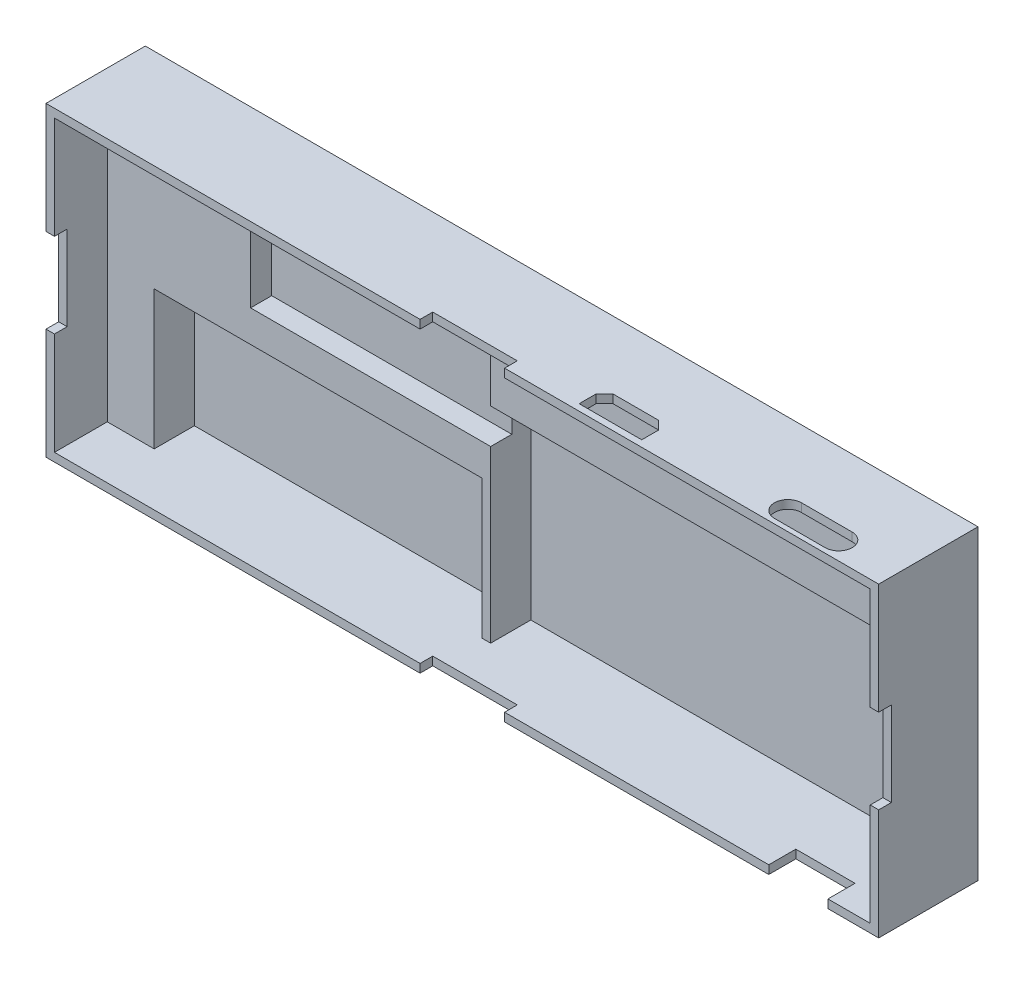
from build123d import *

# Parameters (mm, degrees)
CROQUIS1_W              = 96.5
CROQUIS1_H              = 34.25
SALIENTE_EXTRUIR1_DEPTH = 0.75
CROQUIS3_W              = 98.5
CROQUIS3_H              = 36.25
CROQUIS3_W_2            = 96.5
CROQUIS3_H_2            = 34.25
SALIENTE_EXTRUIR2_DEPTH = 11.75
SALIENTE_EXTRUIR3_DEPTH = 4.75
SALIENTE_EXTRUIR4_DEPTH = 3
SALIENTE_EXTRUIR5_DEPTH = 2.5
CROQUIS8_W              = 1
CROQUIS8_H              = 14.1
CORTAR_EXTRUIR1_DEPTH   = 2.5
CORTAR_EXTRUIR2_DEPTH   = 2.5
CORTAR_EXTRUIR3_DEPTH   = 1.5
CROQUIS11_W             = 7
CROQUIS11_H             = 3.2
CORTAR_EXTRUIR4_DEPTH   = 10


with BuildPart() as part:
    # Croquis1 → Saliente-Extruir1 (new body)
    with BuildSketch(Plane.XY):
        with Locations((-2.825600583, 9.945957096)):
            Rectangle(CROQUIS1_W, CROQUIS1_H)
    extrude(amount=SALIENTE_EXTRUIR1_DEPTH)

    # Croquis3 → Saliente-Extruir2 (add)
    with BuildSketch(Plane(origin=(0, 0, 0), x_dir=(-1, 0, 0), z_dir=(0, 0, -1))):
        with Locations((2.825600583, 9.945957096)):
            Rectangle(CROQUIS3_W, CROQUIS3_H)
        with Locations((2.825600583, 9.945957096)):
            Rectangle(CROQUIS3_W_2, CROQUIS3_H_2, mode=Mode.SUBTRACT)
    extrude(amount=-SALIENTE_EXTRUIR2_DEPTH)

    # Croquis5 → Saliente-Extruir3 (add)
    with BuildSketch(Plane.XY.offset(0.75)):
        Polygon((-5.725600583, -7.179042904), (-5.725600583, 17.120957096), (45.424399417, 17.120957096), (45.424399417, 27.070957096), (-6.725600583, 27.070957096), (-6.725600583, -7.179042904), align=None)
    extrude(amount=SALIENTE_EXTRUIR3_DEPTH)

    # Croquis6 → Saliente-Extruir4 (add)
    with BuildSketch(Plane.XY):
        Polygon((-6.725600583, 9.220957096), (-6.725600583, 27.070957096), (-51.075600583, 27.070957096), (-51.075600583, -7.179042904), (-45.525600583, -7.179042904), (-45.525600583, 9.220957096), align=None)
    extrude(amount=SALIENTE_EXTRUIR4_DEPTH)

    # Croquis7 → Saliente-Extruir5 (add)
    with BuildSketch(Plane.XY.offset(3)):
        Polygon((-34.125600583, 27.070957096), (-51.075600583, 27.070957096), (-51.075600583, -7.179042904), (-45.525600583, -7.179042904), (-45.525600583, 9.220957096), (-6.725600583, 9.220957096), (-6.725600583, 12.970957096), (-34.125600583, 12.970957096), align=None)
    extrude(amount=SALIENTE_EXTRUIR5_DEPTH)

    # Croquis8 → Cortar-Extruir1 (cut)
    with BuildSketch(Plane.XY.offset(5.5)):
        with Locations((-6.225600583, 20.020957096)):
            Rectangle(CROQUIS8_W, CROQUIS8_H)
    extrude(amount=-CORTAR_EXTRUIR1_DEPTH, mode=Mode.SUBTRACT)

    # Croquis9 → Cortar-Extruir2 (cut)
    with BuildSketch(Plane.XZ.offset(-27.070957096)):
        Polygon((10.224399417, 10.98), (17.624399417, 10.98), (17.624399417, 8.98), (16.624399417, 7.98), (11.224399417, 7.98), (10.224399417, 8.98), align=None)
        with BuildLine():
            Line((33.524399417, 11.18), (39.524399417, 11.18))
            ThreePointArc((39.524399417, 11.18), (41.124399417, 9.58), (39.524399417, 7.98))
            Line((39.524399417, 7.98), (33.524399417, 7.98))
            ThreePointArc((33.524399417, 7.98), (31.924399417, 9.58), (33.524399417, 11.18))
        make_face()
    extrude(amount=-CORTAR_EXTRUIR2_DEPTH, mode=Mode.SUBTRACT)

    # Croquis10 → Cortar-Extruir3 (cut)
    with BuildSketch(Plane.XY.offset(11.75)):
        Polygon((-7.825600583, 36.220855399), (2.174399417, 36.220855399), (2.174399417, 14.945957096), (54.759857348, 14.945957096), (54.759857348, 4.945957096), (2.174399417, 4.945957096), (2.174399417, -27.159073942), (-7.825600583, -27.159073942), (-7.825600583, 4.945957096), (-73.50393186, 4.945957096), (-73.50393186, 14.945957096), (-7.825600583, 14.945957096), align=None)
    extrude(amount=-CORTAR_EXTRUIR3_DEPTH, mode=Mode.SUBTRACT)

    # Croquis11 → Cortar-Extruir4 (cut)
    with BuildSketch(Plane.XZ.offset(8.179042904)):
        with Locations((36.924399417, 10.15)):
            Rectangle(CROQUIS11_W, CROQUIS11_H)
    extrude(amount=-CORTAR_EXTRUIR4_DEPTH, mode=Mode.SUBTRACT)


solid = part.part
